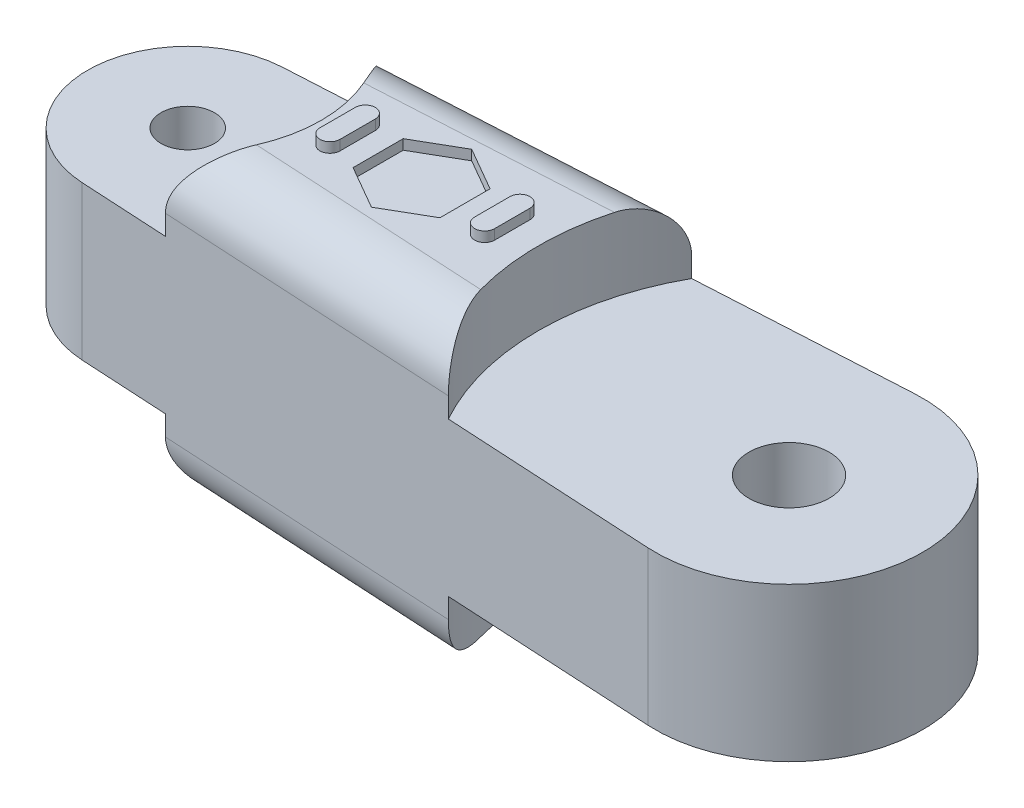
from build123d import *

# Parameters (mm, degrees)
BOSS_EXTRUDE1_DEPTH = 22.5
SKETCH2_R           = 20
SKETCH2_R_2         = 37.5
CUT_EXTRUDE2_DEPTH  = 11
FILLET1_R           = 8
SKETCH3_R           = 6
SKETCH3_R_2         = 4
CUT_EXTRUDE3_DEPTH  = 44.5
CUT_EXTRUDE6_DEPTH  = 1.5
BOSS_EXTRUDE2_DEPTH = 1.5


with BuildPart() as part:
    # Sketch1 → Boss-Extrude1 (new, symmetric)
    with BuildSketch(Plane(origin=(0, 0, 0), x_dir=(1, 0, 0), z_dir=(0, 1, 0))):
        with BuildLine():
            Line((-90.833333333, 14.976833963), (-1.111111111, 19.969111951))
            ThreePointArc((-1.111111111, 19.969111951), (20, 0), (-1.111111111, -19.969111951))
            Line((-1.111111111, -19.969111951), (-90.833333333, -14.976833963))
            ThreePointArc((-90.833333333, -14.976833963), (-105, 0), (-90.833333333, 14.976833963))
        make_face()
    extrude(amount=BOSS_EXTRUDE1_DEPTH, both=True)

    # Sketch2 → Cut-Extrude2 (cut)
    with BuildSketch(Plane(origin=(0, 22.5, 0), x_dir=(1, 0, 0), z_dir=(0, 1, 0))):
        with Locations((-90, 0)):
            Circle(SKETCH2_R)
        Circle(SKETCH2_R_2)
    cut_extrude2 = extrude(amount=-CUT_EXTRUDE2_DEPTH, mode=Mode.SUBTRACT)

    # Mirror1: Cut-Extrude2 across plane
    add(cut_extrude2.mirror(Plane.ZX), mode=Mode.SUBTRACT)

    # Fillet1
    fillet1_edges = [part.edges().sort_by_distance(p)[0] for p in [
        (-55.204285794, 22.5, 16.959287199),
        (-55.204285794, 22.5, -16.959287199),
        (-55.204285794, -22.5, 16.959287199),
        (-55.204285794, -22.5, -16.959287199),
    ]]
    fillet(fillet1_edges, radius=FILLET1_R)

    # Sketch3 → Cut-Extrude3 (cut)
    with BuildSketch(Plane(origin=(0, 11.5, 0), x_dir=(1, 0, 0), z_dir=(0, 1, 0))):
        with Locations(Location((0, 0, 0), (0, 0, 270))):
            Circle(SKETCH3_R)
        with Locations(Location((-90, 0, 0), (0, 0, 270))):
            Circle(SKETCH3_R_2)
    extrude(amount=-CUT_EXTRUDE3_DEPTH, mode=Mode.SUBTRACT)

    # Sketch5 → Cut-Extrude6 (cut)
    with BuildSketch(Plane(origin=(0, 22.5, 0), x_dir=(1, 0, 0), z_dir=(0, 1, 0))):
        Polygon((-55, -7.505553499), (-48.5, -3.75277675), (-48.5, 3.75277675), (-55, 7.505553499), (-61.5, 3.75277675), (-61.5, -3.75277675), align=None)
    cut_extrude6 = extrude(amount=-CUT_EXTRUDE6_DEPTH, mode=Mode.SUBTRACT)

    # Sketch6 → Boss-Extrude2 (add)
    with BuildSketch(Plane(origin=(0, 22.5, 0), x_dir=(1, 0, 0), z_dir=(0, 1, 0))):
        with BuildLine():
            Line((-64.640723816, 2.716865752), (-64.640723816, -2.567368827))
            ThreePointArc((-64.640723816, -2.567368827), (-66.140723816, -4.067368827), (-67.640723816, -2.567368827))
            Line((-67.640723816, -2.567368827), (-67.640723816, 2.716865752))
            ThreePointArc((-67.640723816, 2.716865752), (-66.140723816, 4.216865752), (-64.640723816, 2.716865752))
        make_face()
        with BuildLine():
            Line((-41.5, 2.726821799), (-41.5, -2.55741278))
            ThreePointArc((-41.5, -2.55741278), (-43, -4.05741278), (-44.5, -2.55741278))
            Line((-44.5, -2.55741278), (-44.5, 2.726821799))
            ThreePointArc((-44.5, 2.726821799), (-43, 4.226821799), (-41.5, 2.726821799))
        make_face()
    boss_extrude2 = extrude(amount=BOSS_EXTRUDE2_DEPTH)

    # Mirror2: Cut-Extrude6, Boss-Extrude2 across plane
    add(cut_extrude6.mirror(Plane.ZX), mode=Mode.SUBTRACT)
    add(boss_extrude2.mirror(Plane.ZX))


solid = part.part
